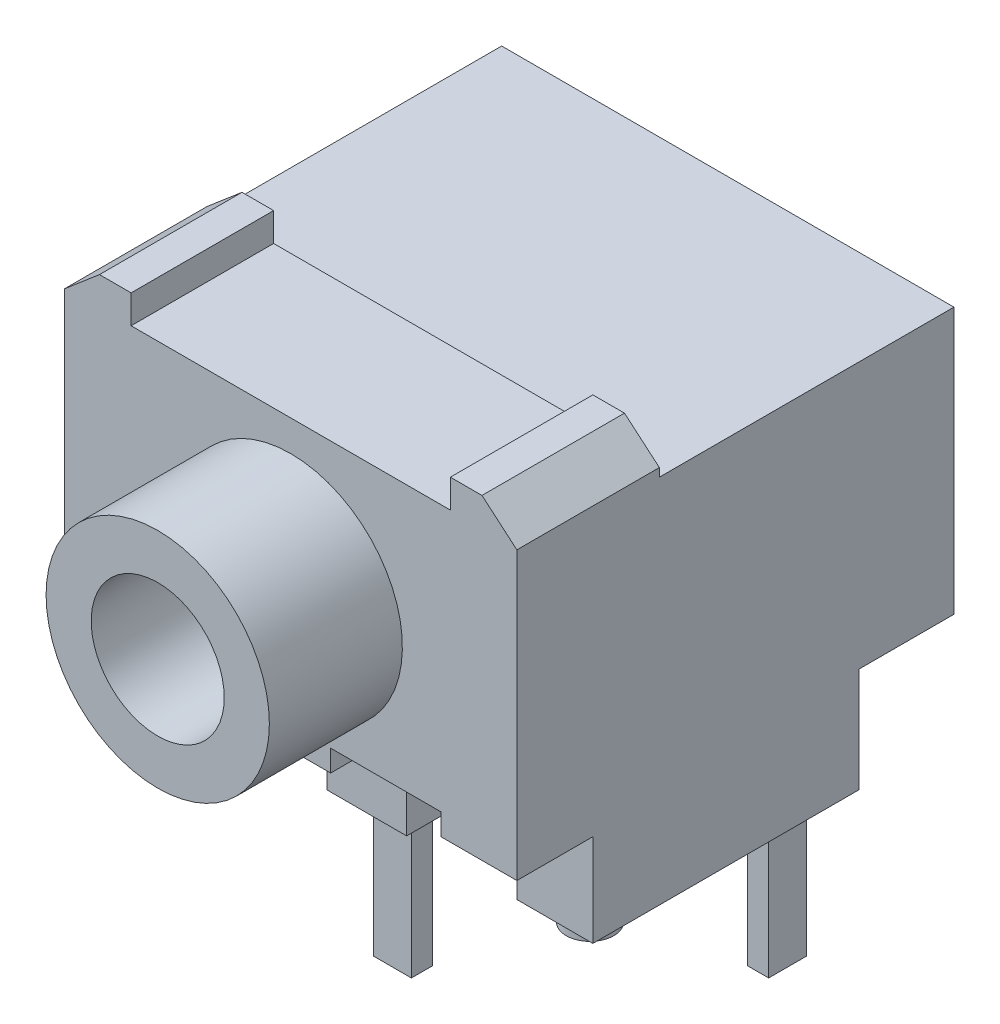
from build123d import *

# Parameters (mm, degrees)
EXTRUDE2_DEPTH     = 6.35
SKETCH3_OUTSIDE_W  = 18.79
SKETCH3_OUTSIDE_H  = 17.063
CUT_EXTRUDE1_DEPTH = 18.24066982
SKETCH6_R          = 2.9845
SKETCH6_R_2        = 1.778
EXTRUDE4_DEPTH     = 3.556
SKETCH7_R          = 0.635
EXTRUDE5_DEPTH     = 0.508
SKETCH8_W          = 1.016
SKETCH8_H          = 0.5588
SKETCH8_W_2        = 0.5588
SKETCH8_H_2        = 1.016
EXTRUDE6_DEPTH     = 3.9116


with BuildPart() as part:
    # Sketch2 → Extrude2 (new, symmetric)
    with BuildSketch(Plane(origin=(0, 0, 0), x_dir=(0, 0, -1), z_dir=(1, 0, 0))):
        Polygon((2.032, 0), (9.144, 0), (9.144, 2.794), (11.684, 2.794), (11.684, 9.906), (3.81, 9.906), (3.81, 10.9728), (0, 10.9728), (0, 2.471612931), (2.032, 2.471612931), align=None)
    extrude(amount=EXTRUDE2_DEPTH, both=True)

    # Sketch3 outside → Cut-Extrude1 (cut, through all)
    with BuildSketch(Plane.XY):
        with Locations((0, 5.4865)):
            Rectangle(SKETCH3_OUTSIDE_W, SKETCH3_OUTSIDE_H)
        Polygon((-4.011698259, 0), (-6.0452, 0), (-6.0452, 10.128452415), (-5.112567083, 10.922), (-4.2672, 10.922), (-4.2672, 10.16), (4.2672, 10.16), (4.2672, 10.922), (5.112567083, 10.922), (6.0452, 10.128452415), (6.0452, 0), (4.011698259, 0), (4.011698259, 3.048), (1.0668, 3.048), (1.0668, 0), (-1.0668, 0), (-1.0668, 3.048), (-4.011698259, 3.048), align=None, mode=Mode.SUBTRACT)
    extrude(amount=-CUT_EXTRUDE1_DEPTH, mode=Mode.SUBTRACT)

    # Sketch6 → Extrude4 (add)
    with BuildSketch(Plane.XY):
        with Locations(Location((0, 6.35, 0), (0, 0, 90))):
            Circle(SKETCH6_R)
        with Locations((0, 6.35)):
            Circle(SKETCH6_R_2, mode=Mode.SUBTRACT)
    extrude(amount=EXTRUDE4_DEPTH)

    # Sketch7 → Extrude5 (add)
    with BuildSketch(Plane(origin=(0, 0, 0), x_dir=(1, 0, 0), z_dir=(0, 1, 0))):
        with Locations(Location((0, 8.001, 0), (0, 0, 270))):
            Circle(SKETCH7_R)
        with Locations(Location((5.0038, 2.9972, 0), (0, 0, 270))):
            Circle(SKETCH7_R)
        with Locations(Location((-5.0038, 2.9972, 0), (0, 0, 270))):
            Circle(SKETCH7_R)
    extrude(amount=-EXTRUDE5_DEPTH)

    # Sketch8 → Extrude6 (add)
    with BuildSketch(Plane(origin=(0, 0, 0), x_dir=(1, 0, 0), z_dir=(0, 1, 0))):
        with Locations((0, 2.9972)):
            Rectangle(SKETCH8_W, SKETCH8_H)
        with Locations((-5.0038, 8.001)):
            Rectangle(SKETCH8_W_2, SKETCH8_H_2)
        with Locations((5.0038, 8.001)):
            Rectangle(SKETCH8_W_2, SKETCH8_H_2)
    extrude(amount=-EXTRUDE6_DEPTH)


solid = part.part
